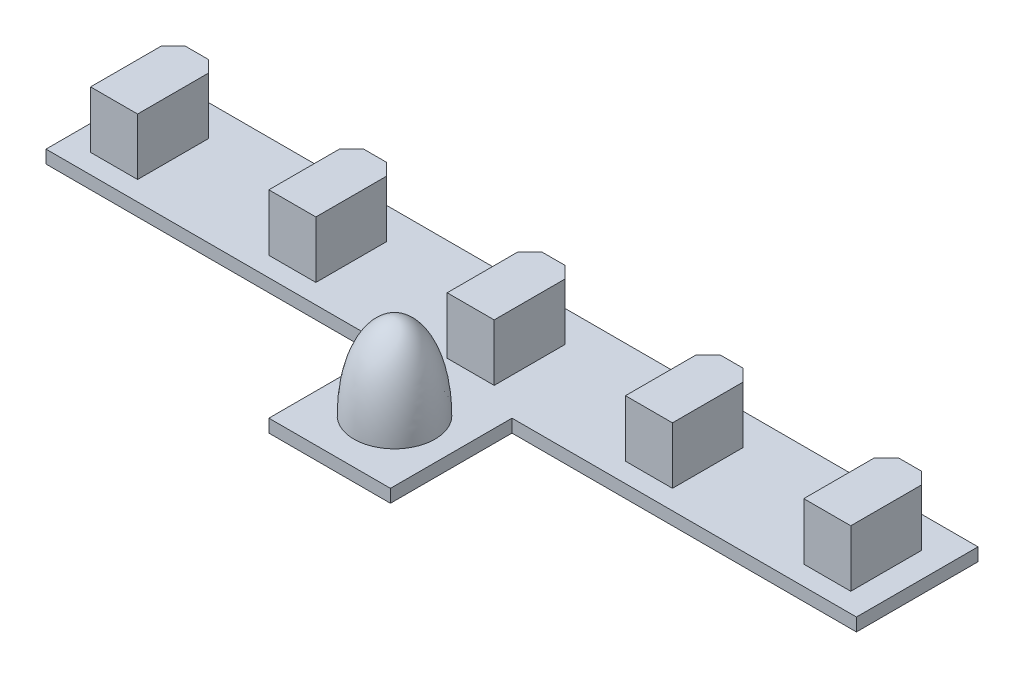
from build123d import *

# Parameters (mm, degrees)
BOSS_EXTRUDE1_DEPTH = 1.6
SKETCH1_3_W         = 10.56
SKETCH1_3_H         = 5
BOSS_EXTRUDE2_DEPTH = 2
BOSS_EXTRUDE3_DEPTH = 8.6


with BuildPart() as part:
    # Sketch1 → Boss-Extrude1 (new body)
    with BuildSketch(Plane(origin=(0, 0, 0), x_dir=(1, 0, 0), z_dir=(0, 1, 0))):
        Polygon((-7.5, 10.5), (-7.5, -4.5), (7.5, -4.5), (7.5, 10.5), (50, 10.5), (50, 25.5), (-50, 25.5), (-50, 10.5), align=None)
        Polygon((46.9, 21.630697763), (46.9, 12.9), (41.1, 12.9), (41.1, 21.630697763), (42.569302237, 23.1), (45.430697763, 23.1), align=None, mode=Mode.SUBTRACT)
        Polygon((-42.569302237, 23.1), (-41.1, 21.630697763), (-41.1, 12.9), (-46.9, 12.9), (-46.9, 21.630697763), (-45.430697763, 23.1), align=None, mode=Mode.SUBTRACT)
        Polygon((-20.569302237, 23.1), (-19.1, 21.630697763), (-19.1, 12.9), (-24.9, 12.9), (-24.9, 21.630697763), (-23.430697763, 23.1), align=None, mode=Mode.SUBTRACT)
        Polygon((2.9, 12.9), (-2.9, 12.9), (-2.9, 21.630697763), (-1.430697763, 23.1), (1.430697763, 23.1), (2.9, 21.630697763), align=None, mode=Mode.SUBTRACT)
        Polygon((23.430697763, 23.1), (24.9, 21.630697763), (24.9, 12.9), (19.1, 12.9), (19.1, 21.630697763), (20.569302237, 23.1), align=None, mode=Mode.SUBTRACT)
    extrude(amount=BOSS_EXTRUDE1_DEPTH)

    # Sketch1<3> → Boss-Extrude2 (add)
    with BuildSketch(Plane(origin=(0, 0, 0), x_dir=(1, 0, 0), z_dir=(0, 1, 0))):
        Rectangle(SKETCH1_3_W, SKETCH1_3_H)
    extrude(amount=-BOSS_EXTRUDE2_DEPTH)

    # Sketch1<4> → Boss-Extrude3 (add)
    with BuildSketch(Plane(origin=(0, 0, 0), x_dir=(1, 0, 0), z_dir=(0, 1, 0))):
        Polygon((-2.9, 21.630697763), (-2.9, 12.9), (2.9, 12.9), (2.9, 21.630697763), (1.430697763, 23.1), (-1.430697763, 23.1), align=None)
        Polygon((24.9, 12.9), (24.9, 21.630697763), (23.430697763, 23.1), (20.569302237, 23.1), (19.1, 21.630697763), (19.1, 12.9), align=None)
        Polygon((46.9, 12.9), (46.9, 21.630697763), (45.430697763, 23.1), (42.569302237, 23.1), (41.1, 21.630697763), (41.1, 12.9), align=None)
        Polygon((-19.1, 12.9), (-19.1, 21.630697763), (-20.569302237, 23.1), (-23.430697763, 23.1), (-24.9, 21.630697763), (-24.9, 12.9), align=None)
        Polygon((-41.1, 12.9), (-41.1, 21.630697763), (-42.569302237, 23.1), (-45.430697763, 23.1), (-46.9, 21.630697763), (-46.9, 12.9), align=None)
    extrude(amount=BOSS_EXTRUDE3_DEPTH)

    # Sketch3 → Revolve2 (revolve)
    with BuildSketch(Plane(origin=(0, 0, 0), x_dir=(0, 0, -1), z_dir=(1, 0, 0))):
        with BuildLine():
            add(Edge.make_bspline(
                [(-1.5, 1.6), (-1.5, 8.223178145), (1, 11.999705618), (3.5, 12.1)],
                knots=[0, 0, 0, 0, 0.5, 0.5, 0.5, 0.5], degree=3))
            Line((-1.5, 1.6), (3.5, 1.6))
            Line((3.5, 1.6), (3.5, 12.1))
        make_face()
    revolve(axis=Axis((0, 12.1, -3.5), (0, -1, 0)))


solid = part.part
